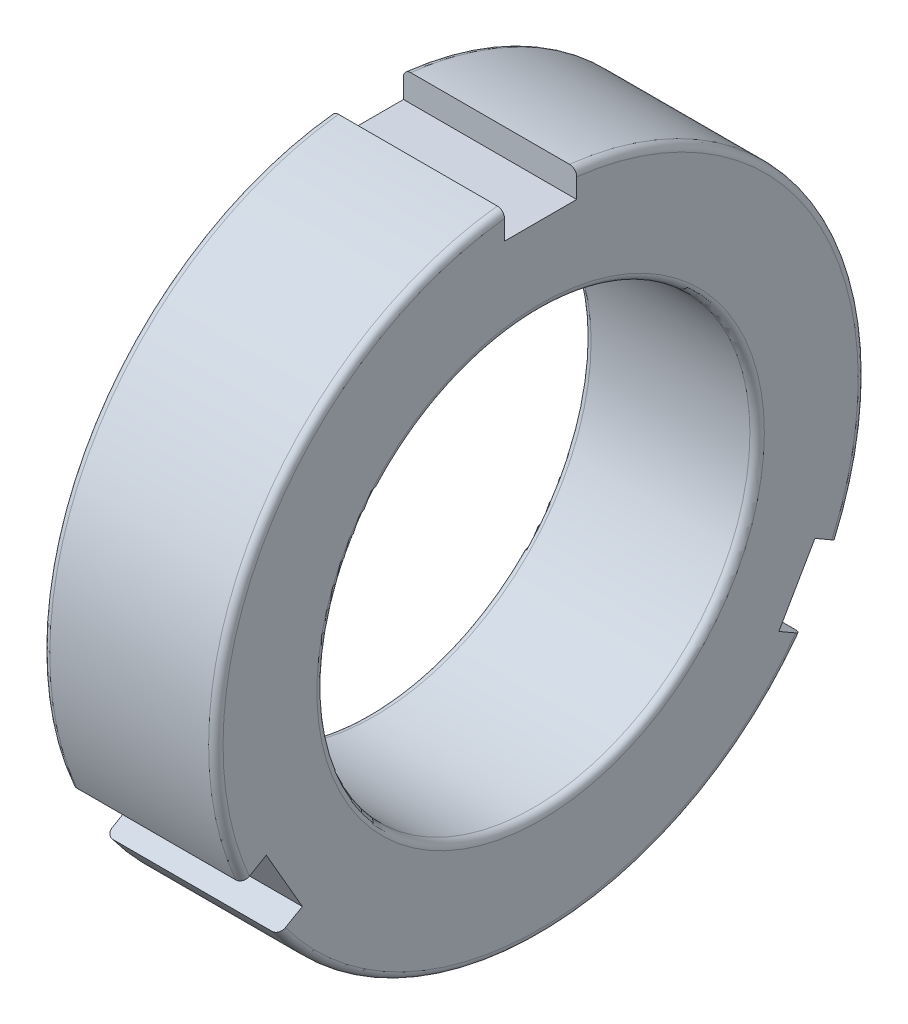
from build123d import *

# Parameters (mm, degrees)
SKETCH_7_R      = 15
EXTRUDE_2_DEPTH = 12
FILLET_1_R      = 0.5


with BuildPart() as part:
    # 草图7 → 凸台-拉伸2 (new body)
    with BuildSketch(Plane(origin=(0, 0, 0), x_dir=(0, 0, -1), z_dir=(1, 0, 0))):
        with BuildLine():
            Line((18.114916731, -13.345403397), (16.503520778, -12.415063509))
            Line((16.503520778, -12.415063509), (19.003520778, -8.084936491))
            Line((19.003520778, -8.084936491), (20.614916731, -9.015276378))
            ThreePointArc((20.614916731, -9.015276378), (19.485571585, 11.25), (2.5, 22.360679775))
            Line((2.5, 22.360679775), (2.5, 20.5))
            Line((2.5, 20.5), (-2.5, 20.5))
            Line((-2.5, 20.5), (-2.5, 22.360679775))
            ThreePointArc((-2.5, 22.360679775), (-19.485571585, 11.25), (-20.614916731, -9.015276378))
            Line((-20.614916731, -9.015276378), (-19.003520778, -8.084936491))
            Line((-19.003520778, -8.084936491), (-16.503520778, -12.415063509))
            Line((-16.503520778, -12.415063509), (-18.114916731, -13.345403397))
            ThreePointArc((-18.114916731, -13.345403397), (0, -22.5), (18.114916731, -13.345403397))
        make_face()
        Circle(SKETCH_7_R, mode=Mode.SUBTRACT)
    extrude(amount=EXTRUDE_2_DEPTH)

    # 圆角1
    fillet_1_edges = [part.edges().sort_by_distance(p)[0] for p in [
        (0, 11.25, -19.485571585),
        (0, -22.5, 0),
        (0, 11.25, 19.485571585),
        (0, 0, 15),
        (12, 0, 15),
        (12, 11.25, -19.485571585),
        (12, 11.25, 19.485571585),
        (12, -22.5, 0),
    ]]
    fillet(fillet_1_edges, radius=FILLET_1_R)


solid = part.part
